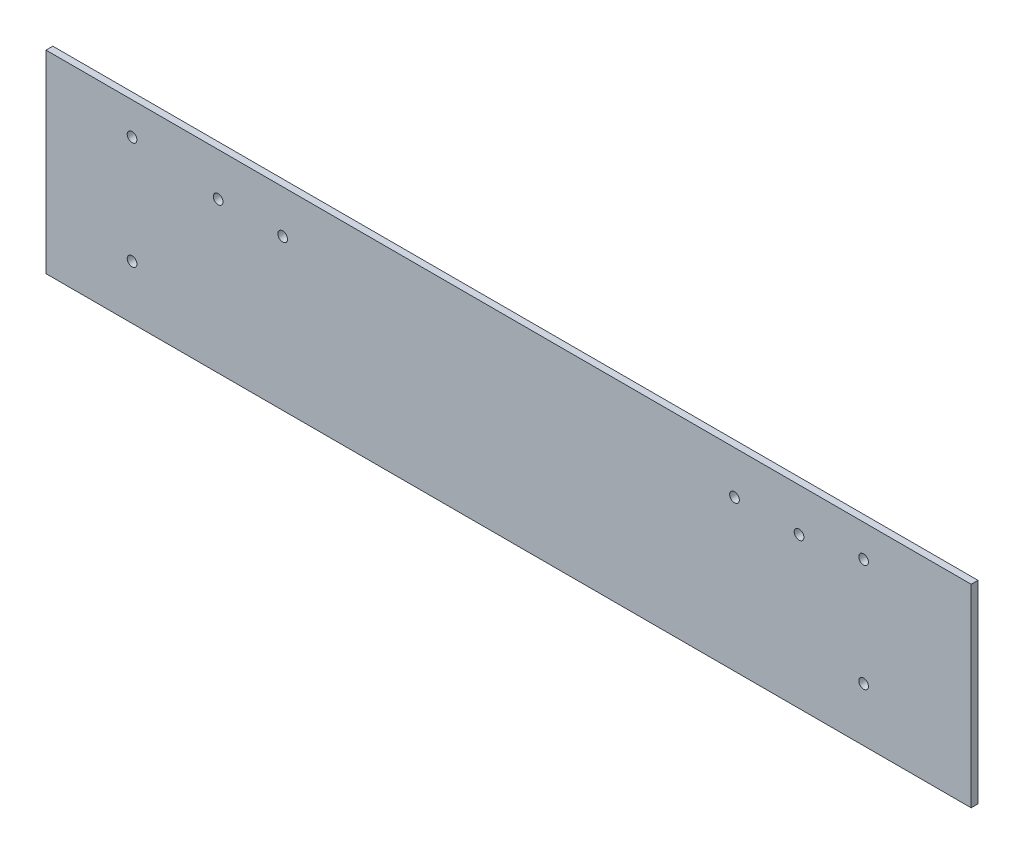
from build123d import *

# Parameters (mm, degrees)
SKETCH1_W            = 430
SKETCH1_H            = 90
BOSS_EXTRUDE1_DEPTH  = 3.175
M4_CLEARANCE_HOLE1_D = 4.5
M4_CLEARANCE_HOLE2_D = 4.5


with BuildPart() as part:
    # Sketch1 → Boss-Extrude1 (new body)
    with BuildSketch(Plane.XY):
        Rectangle(SKETCH1_W, SKETCH1_H)
    extrude(amount=BOSS_EXTRUDE1_DEPTH)

    # M4 Clearance Hole1 (through all)
    with Locations(Plane.XY.offset(3.175)):
        with Locations((165, 30), (-175, -20), (-175, 30), (165, -20)):
            Hole(M4_CLEARANCE_HOLE1_D / 2)

    # M4 Clearance Hole2 (through all)
    with Locations(Plane.XY.offset(3.175)):
        with Locations((-135, 25), (-105, 25)):
            m4_clearance_hole2 = Hole(M4_CLEARANCE_HOLE2_D / 2)

    # Mirror1: M4 Clearance Hole2 across plane
    add(m4_clearance_hole2.mirror(Plane(origin=(0, 0, 0), x_dir=(0, 0, 1), z_dir=(1, 0, 0))), mode=Mode.SUBTRACT)


solid = part.part
